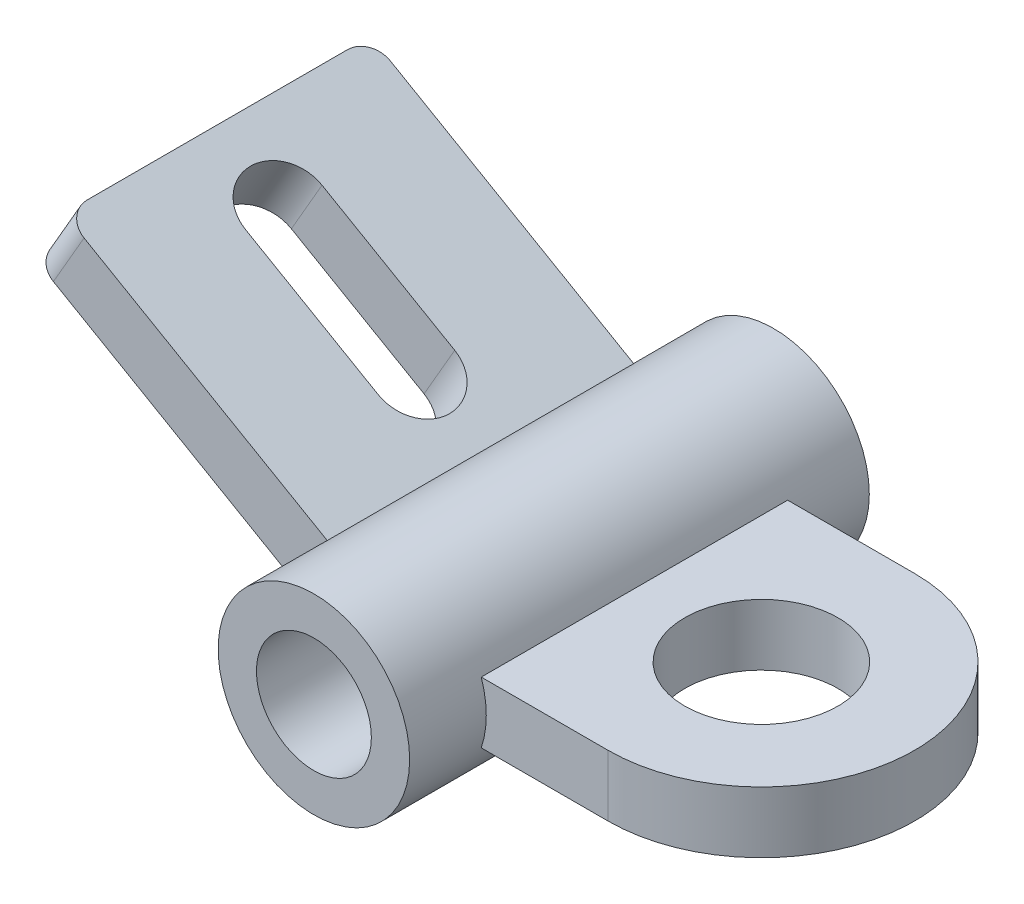
from build123d import *

# Parameters (mm, degrees)
SKETCH2_R           = 10
BOSS_EXTRUDE1_DEPTH = 8
SKETCH3_R           = 12.5
SKETCH3_R_2         = 7.5
BOSS_EXTRUDE2_DEPTH = 50
BOSS_EXTRUDE3_START = 10
SKETCH4_R           = 12.5
SKETCH4_R_2         = 7.5
BOSS_EXTRUDE3_DEPTH = 10
BOSS_EXTRUDE4_DEPTH = 40
CUT_EXTRUDE1_DEPTH  = 72.52071964
FILLET1_R           = 3


with BuildPart() as part:
    # Sketch2 → Boss-Extrude1 (new body)
    with BuildSketch(Plane(origin=(0, 0, 0), x_dir=(1, 0, 0), z_dir=(0, 1, 0))):
        with BuildLine():
            Line((0, 27.802301255), (0, -12.197698745))
            Line((0, -12.197698745), (19.5, -12.197698745))
            ThreePointArc((19.5, -12.197698745), (39.5, 7.802301255), (19.5, 27.802301255))
            Line((19.5, 27.802301255), (0, 27.802301255))
        make_face()
        with Locations(Location((19.5, 7.802301255, 0), (0, 0, 270))):
            Circle(SKETCH2_R, mode=Mode.SUBTRACT)
    extrude(amount=-BOSS_EXTRUDE1_DEPTH)

    # Sketch3 → Boss-Extrude2 (add)
    with BuildSketch(Plane.XY.offset(12.197698745)):
        with Locations((-8.910855114, -4)):
            Circle(SKETCH3_R)
        with Locations((-8.910855114, -4)):
            Circle(SKETCH3_R_2, mode=Mode.SUBTRACT)
    extrude(amount=-BOSS_EXTRUDE2_DEPTH)

    # Sketch4 → Boss-Extrude3 (add)
    with BuildSketch(Plane.XY.offset(12.197698745).offset(BOSS_EXTRUDE3_START)):
        with Locations((-8.910855114, -4)):
            Circle(SKETCH4_R)
        with Locations((-8.910855114, -4)):
            Circle(SKETCH4_R_2, mode=Mode.SUBTRACT)
    extrude(amount=-BOSS_EXTRUDE3_DEPTH)

    # Sketch6 → Boss-Extrude4 (add)
    with BuildSketch(Plane.XY.offset(12.197698745)):
        Polygon((-18.032516938, -3.352408244), (-55.511163409, 18.285898385), (-51.511163409, 25.214101615), (-14.032516938, 3.575794986), align=None)
    extrude(amount=-BOSS_EXTRUDE4_DEPTH)

    # Sketch7 → Cut-Extrude1 (cut, through all)
    with BuildSketch(Plane(origin=(-1.959764586, -3.394411834, 0), x_dir=(0.866025403784438, -0.500000000000001, 0), z_dir=(0.500000000000001, 0.866025403784438, 0))):
        with BuildLine():
            Line((-47.217026898, 12.802301255), (-27.217026898, 12.802301255))
            ThreePointArc((-27.217026898, 12.802301255), (-22.217026898, 7.802301255), (-27.217026898, 2.802301255))
            Line((-27.217026898, 2.802301255), (-47.217026898, 2.802301255))
            ThreePointArc((-47.217026898, 2.802301255), (-52.217026898, 7.802301255), (-47.217026898, 12.802301255))
        make_face()
    extrude(amount=-CUT_EXTRUDE1_DEPTH, mode=Mode.SUBTRACT)

    # Fillet1
    fillet1_edges = [part.edges().sort_by_distance(p)[0] for p in [
        (-53.511163409, 21.75, -27.802301255),
        (-53.511163409, 21.75, 12.197698745),
    ]]
    fillet(fillet1_edges, radius=FILLET1_R)


solid = part.part
